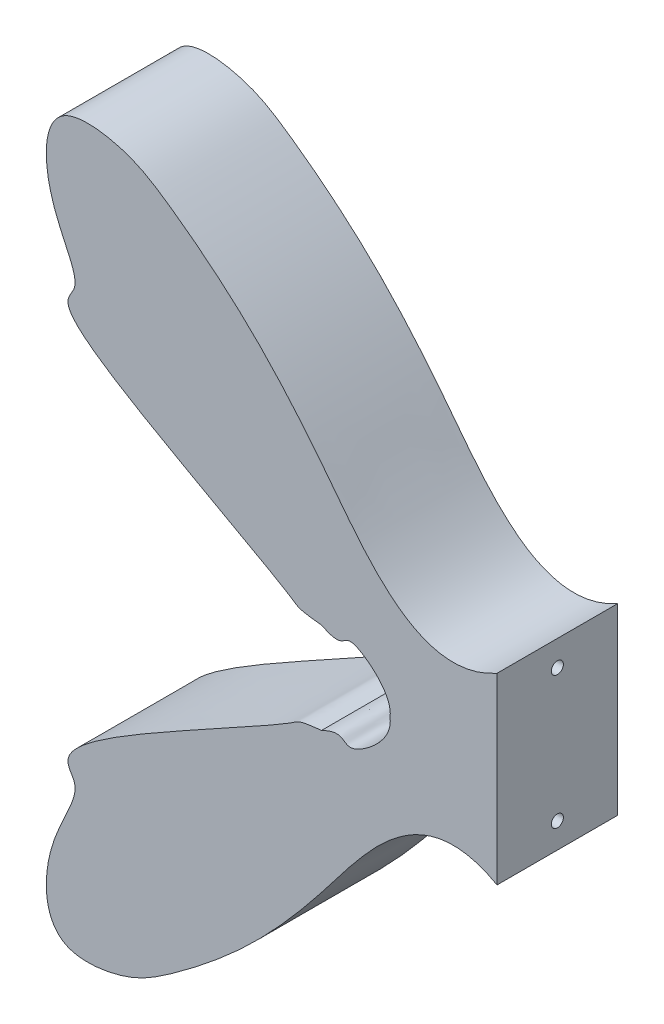
from build123d import *

# Parameters (mm, degrees)
BOSS_EXTRUDE1_DEPTH = 10
SKETCH2_R           = 1
CUT_EXTRUDE1_DEPTH  = 5


with BuildPart() as part:
    # Sketch1 → Boss-Extrude1 (new, symmetric)
    with BuildSketch(Plane.XY):
        with BuildLine():
            Line((71.632510406, 15.197185343), (71.632510406, -15.197185343))
            add(Edge.make_bspline(
                [(71.632510406, -15.197185343), (58.973888962, -8.099234258), (42.568084718, -32.157579469), (28.361465025, -46.95355491), (16.440186779, -55.972993318), (10.128261681, -59.758434669), (-3.894443649, -61.597806854), (-3.782933309, -46.583436705), (4.750286433, -33.661835178), (-6.003959955, -32.35355901), (39.719078976, -8.266617272), (38.53678703, -8.004697705), (42.538591951, -7.554346475)],
                knots=[0, 0, 0, 0, 0.127762808, 0.242354711, 0.328153111, 0.413844965, 0.506383101, 0.653085728, 0.740125662, 0.845652717, 0.902495188, 0.926083422, 0.926083422, 0.926083422, 0.926083422], degree=3))
            add(Edge.make_bspline(
                [(42.538591951, -7.554346475), (47.032105816, -5.309631018), (44.778871614, -10.936915734), (54.33791061, -3.134330539), (53.89271199, 0)],
                knots=[0, 0, 0, 0, 0.786447223, 1.267000531, 1.267000531, 1.267000531, 1.267000531], degree=3))
            add(Edge.make_bspline(
                [(42.538591951, 7.554346475), (47.032105816, 5.309631018), (44.778871614, 10.936915734), (54.33791061, 3.134330539), (53.89271199, 0)],
                knots=[0, 0, 0, 0, 0.786447223, 1.267000531, 1.267000531, 1.267000531, 1.267000531], degree=3))
            add(Edge.make_bspline(
                [(71.632510406, 15.197185343), (58.973888962, 8.099234258), (42.568084718, 32.157579469), (28.361465025, 46.95355491), (16.440186779, 55.972993318), (10.128261681, 59.758434669), (-3.894443649, 61.597806854), (-3.782933309, 46.583436705), (4.750286433, 33.661835178), (-6.003959955, 32.35355901), (39.719078976, 8.266617272), (38.53678703, 8.004697705), (42.538591951, 7.554346475)],
                knots=[0, 0, 0, 0, 0.127762808, 0.242354711, 0.328153111, 0.413844965, 0.506383101, 0.653085728, 0.740125662, 0.845652717, 0.902495188, 0.926083422, 0.926083422, 0.926083422, 0.926083422], degree=3))
        make_face()
    extrude(amount=BOSS_EXTRUDE1_DEPTH, both=True)

    # Sketch2 → Cut-Extrude1 (cut)
    with BuildSketch(Plane(origin=(71.632510406, 0, 0), x_dir=(0, 0, -1), z_dir=(1, 0, 0))):
        with Locations((0, 11)):
            Circle(SKETCH2_R)
        with Locations(Location((0, -11, 0), (0, 0, 180))):
            Circle(SKETCH2_R)
    extrude(amount=-CUT_EXTRUDE1_DEPTH, mode=Mode.SUBTRACT)


solid = part.part
